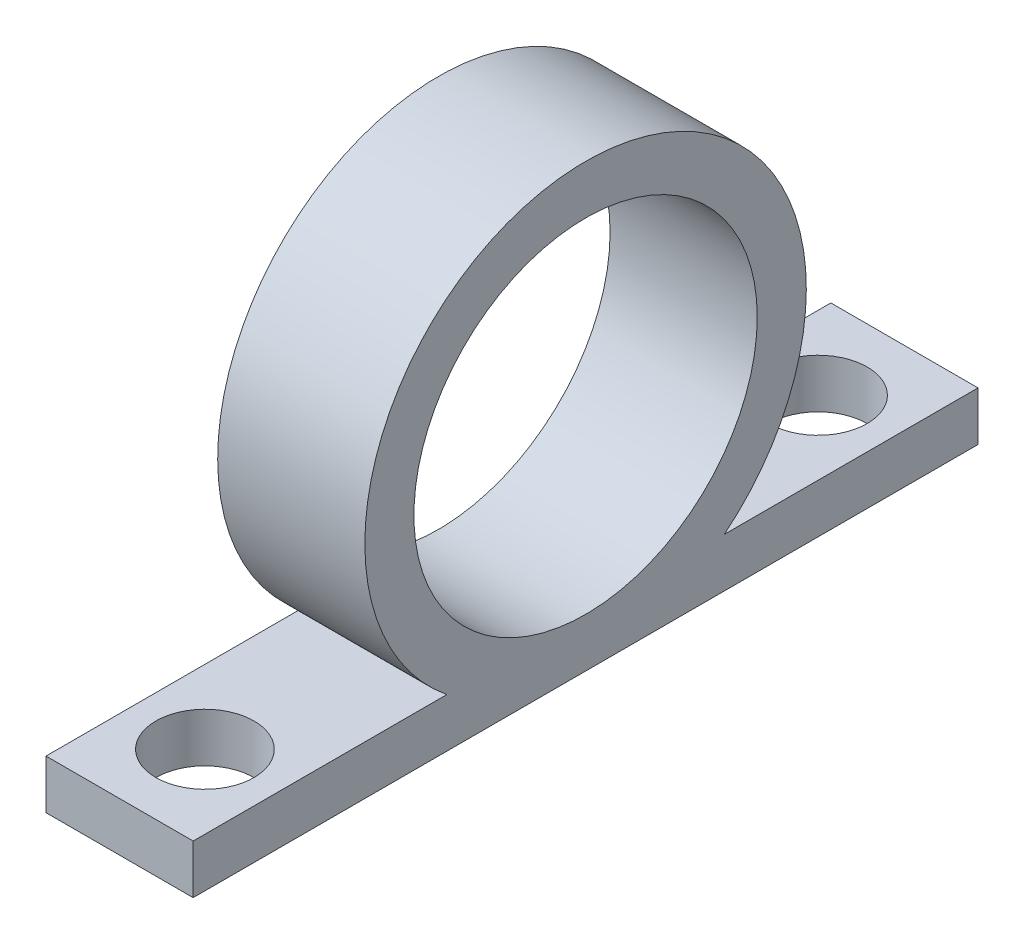
from build123d import *

# Parameters (mm, degrees)
SKETCH1_R           = 35
BOSS_EXTRUDE1_DEPTH = 30
SKETCH2_R           = 10
CUT_EXTRUDE1_DEPTH  = 30


with BuildPart() as part:
    # Sketch1 → Boss-Extrude1 (new body)
    with BuildSketch(Plane(origin=(0, 0, 0), x_dir=(0, 0, -1), z_dir=(1, 0, 0))):
        with BuildLine():
            Line((0, -45), (80, -45))
            Line((80, -45), (80, -35))
            Line((80, -35), (28.284271247, -35))
            ThreePointArc((28.284271247, -35), (0, 45), (-28.284271247, -35))
            Line((-28.284271247, -35), (-80, -35))
            Line((-80, -35), (-80, -45))
            Line((-80, -45), (0, -45))
        make_face()
        Circle(SKETCH1_R, mode=Mode.SUBTRACT)
    extrude(amount=BOSS_EXTRUDE1_DEPTH)

    # Sketch2 → Cut-Extrude1 (cut)
    with BuildSketch(Plane(origin=(0, -35, 0), x_dir=(1, 0, 0), z_dir=(0, 1, 0))):
        with Locations(Location((15, 62.399384691, 0), (0, 0, 270))):
            Circle(SKETCH2_R)
        with Locations(Location((15, -62.600615309, 0), (0, 0, 270))):
            Circle(SKETCH2_R)
    extrude(amount=-CUT_EXTRUDE1_DEPTH, mode=Mode.SUBTRACT)


solid = part.part
